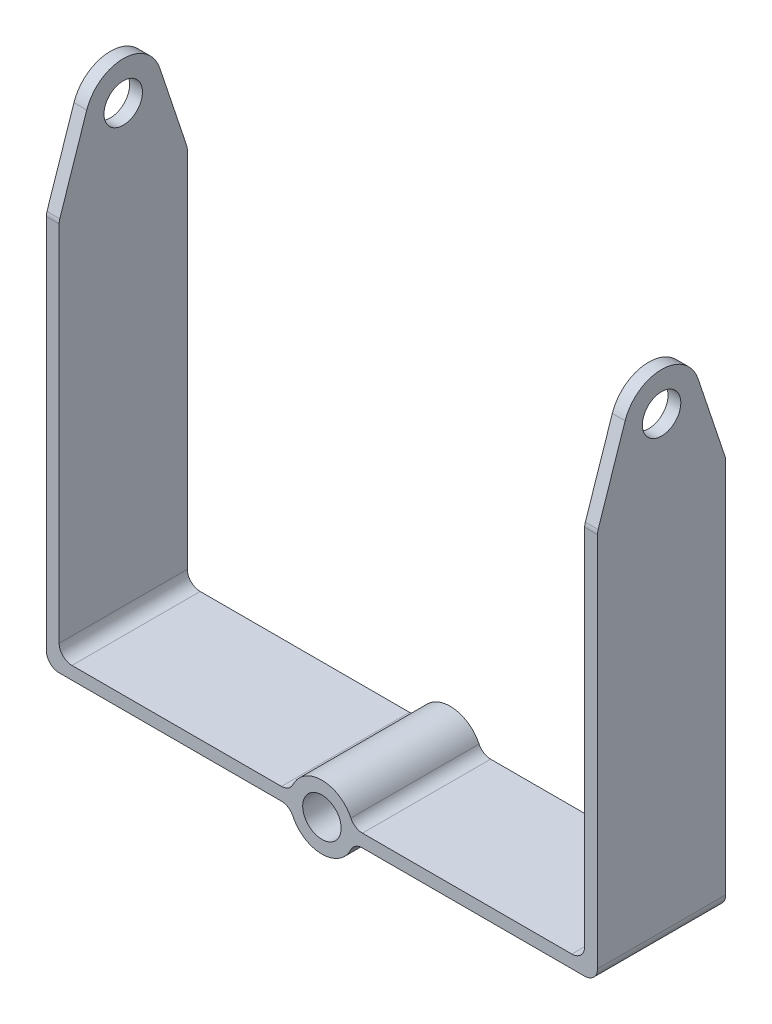
from build123d import *

# Parameters (mm, degrees)
ESQUISSE1_R             = 15
BOSS_EXTRU_1_DEPTH      = 100
ESQUISSE2_R             = 15
ENL_V_MAT_EXTRU_1_DEPTH = 590.067059001
CONG_1_R                = 10


with BuildPart() as part:
    # Esquisse1 → Boss.-Extru.1 (new body)
    with BuildSketch(Plane.XY):
        with BuildLine():
            Line((10, 0), (190.505102572, 0))
            ThreePointArc((190.505102572, 0), (215, -20), (239.494897428, 0))
            Line((239.494897428, 0), (420, 0))
            Line((420, 0), (430, 0))
            Line((430, 0), (430, 390))
            Line((430, 390), (420, 390))
            Line((420, 390), (420, 10))
            Line((420, 10), (239.494897428, 10))
            ThreePointArc((239.494897428, 10), (215, 30), (190.505102572, 10))
            Line((190.505102572, 10), (10, 10))
            Line((10, 10), (10, 390))
            Line((10, 390), (0, 390))
            Line((0, 390), (0, 0))
            Line((0, 0), (10, 0))
        make_face()
        with Locations((215, 5)):
            Circle(ESQUISSE1_R, mode=Mode.SUBTRACT)
    extrude(amount=BOSS_EXTRU_1_DEPTH)

    # Esquisse2 → Enlèv. mat.-Extru.1 (cut, through all)
    with BuildSketch(Plane(origin=(430, 0, 0), x_dir=(0, 0, -1), z_dir=(1, 0, 0))):
        with BuildLine():
            Line((-100, 305), (-78.45468447, 369.504258609))
            ThreePointArc((-78.45468447, 369.504258609), (-67.533856417, 384.342635008), (-50, 390))
            Line((-50, 390), (-100, 390))
            Line((-100, 390), (-100, 305))
        make_face()
        Polygon((-120.94696684, 305), (-100, 305), (-100, 390), (-50, 390), (0, 390), (0, 305), (20.94696684, 305), (20.94696684, 555.583179512), (-120.94696684, 555.583179512), align=None)
        with BuildLine():
            Line((0, 390), (-50, 390))
            ThreePointArc((-50, 390), (-32.466143583, 384.342635008), (-21.54531553, 369.504258609))
            Line((-21.54531553, 369.504258609), (0, 305))
            Line((0, 305), (0, 390))
        make_face()
        with Locations(Location((-50, 360, 0), (0, 0, 90))):
            Circle(ESQUISSE2_R)
    extrude(amount=-ENL_V_MAT_EXTRU_1_DEPTH, mode=Mode.SUBTRACT)

    # Congé1
    cong_1_edges = [part.edges().sort_by_distance(p)[0] for p in [
        (0, 0, 50),
        (10, 10, 50),
        (190.505102572, 10, 50),
        (239.494897428, 10, 50),
        (420, 10, 50),
        (430, 0, 50),
        (239.494897428, 0, 50),
        (190.505102572, 0, 50),
        (425, 305, 0),
        (425, 305, 100),
        (5, 305, 100),
        (5, 305, 0),
    ]]
    fillet(cong_1_edges, radius=CONG_1_R)


solid = part.part
